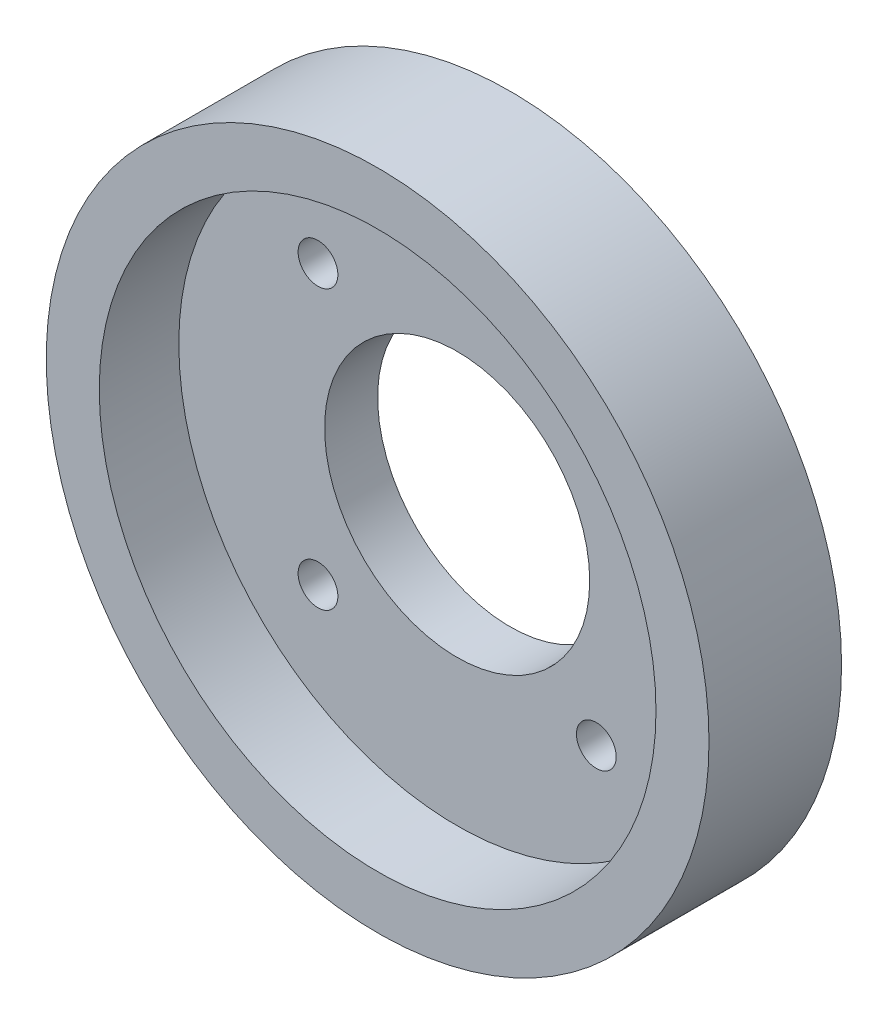
from build123d import *

# Parameters (mm, degrees)
ESQUISSE1_R        = 12.5
ESQUISSE1_R_2      = 5
ESQUISSE1_R_3      = 0.75
BOSS_EXTRU_1_DEPTH = 2
ESQUISSE2_R        = 12.5
ESQUISSE2_R_2      = 10.5
BOSS_EXTRU_2_DEPTH = 3


with BuildPart() as part:
    # Esquisse1 → Boss.-Extru.1 (new body)
    with BuildSketch(Plane.XY):
        Circle(ESQUISSE1_R)
        Circle(ESQUISSE1_R_2, mode=Mode.SUBTRACT)
        with Locations((-5.25, 5.25)):
            Circle(ESQUISSE1_R_3, mode=Mode.SUBTRACT)
        with Locations((5.25, 5.25)):
            Circle(ESQUISSE1_R_3, mode=Mode.SUBTRACT)
        with Locations((5.25, -5.25)):
            Circle(ESQUISSE1_R_3, mode=Mode.SUBTRACT)
        with Locations((-5.25, -5.25)):
            Circle(ESQUISSE1_R_3, mode=Mode.SUBTRACT)
    extrude(amount=BOSS_EXTRU_1_DEPTH)

    # Esquisse2 → Boss.-Extru.2 (add)
    with BuildSketch(Plane.XY.offset(2)):
        Circle(ESQUISSE2_R)
        Circle(ESQUISSE2_R_2, mode=Mode.SUBTRACT)
    extrude(amount=BOSS_EXTRU_2_DEPTH)


solid = part.part
